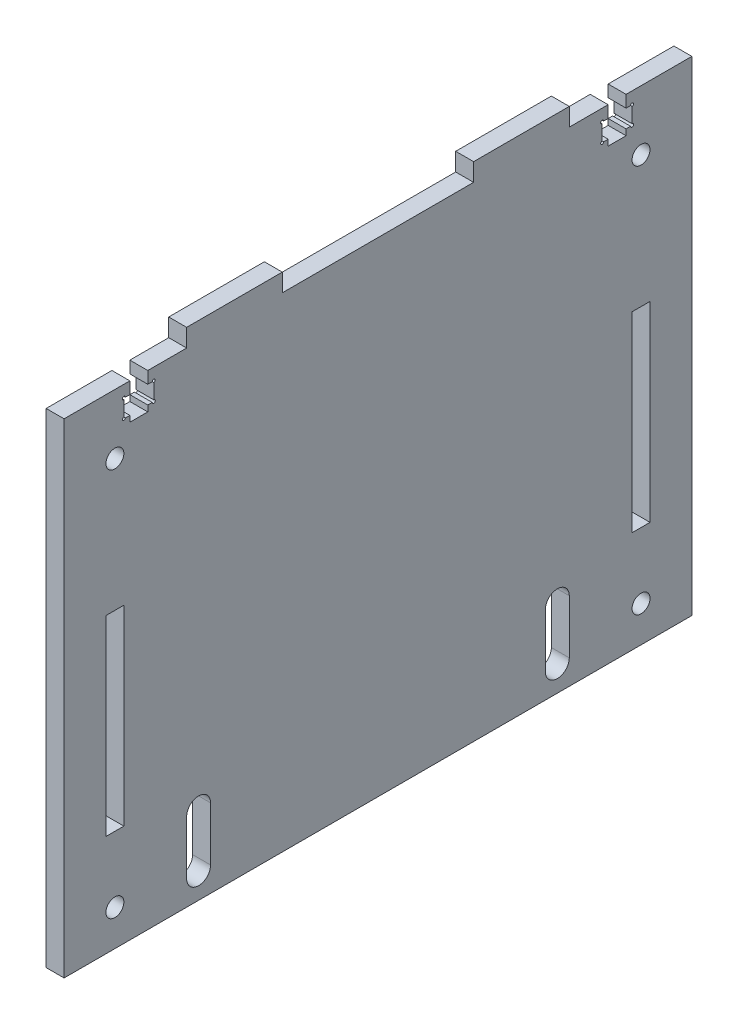
from build123d import *

# Parameters (mm, degrees)
CROQUIS1_R              = 1.5
CROQUIS1_W              = 3
CROQUIS1_H              = 32
SALIENTE_EXTRUIR1_DEPTH = 3
CORTAR_EXTRUIR1_DEPTH   = 3
CORTAR_EXTRUIR2_DEPTH   = 3


with BuildPart() as part:
    # Croquis1 → Saliente-Extruir1 (new body)
    with BuildSketch(Plane(origin=(0, 0, 0), x_dir=(0, 0, -1), z_dir=(1, 0, 0))):
        Polygon((0, 0), (105, 0), (105, 81), (84.5, 81), (84.5, 84), (68.5, 84), (68.5, 81), (36.5, 81), (36.5, 84), (20.5, 84), (20.5, 81), (0, 81), align=None)
        with Locations((8.5, 71)):
            Circle(CROQUIS1_R, mode=Mode.SUBTRACT)
        with Locations((96.5, 71)):
            Circle(CROQUIS1_R, mode=Mode.SUBTRACT)
        with Locations((8.5, 6)):
            Circle(CROQUIS1_R, mode=Mode.SUBTRACT)
        with Locations(Location((96.5, 6, 0), (0, 0, 180))):
            Circle(CROQUIS1_R, mode=Mode.SUBTRACT)
        with Locations((8.5, 33)):
            Rectangle(CROQUIS1_W, CROQUIS1_H, mode=Mode.SUBTRACT)
        with Locations((96.5, 33)):
            Rectangle(CROQUIS1_W, CROQUIS1_H, mode=Mode.SUBTRACT)
    extrude(amount=SALIENTE_EXTRUIR1_DEPTH)

    # Croquis2 → Cortar-Extruir1 (cut)
    with BuildSketch(Plane(origin=(3, 0, 0), x_dir=(0, 0, -1), z_dir=(1, 0, 0))):
        with BuildLine():
            Line((14, 79), (14, 81))
            Line((14, 81), (11, 81))
            Line((11, 81), (11, 79))
            Line((11, 79), (10.25, 79))
            ThreePointArc((10.25, 79), (9.823223305, 79.176776695), (10, 78.75))
            Line((10, 78.75), (10, 76.25))
            ThreePointArc((10, 76.25), (9.823223305, 75.823223305), (10.25, 76))
            Line((10.25, 76), (11, 76))
            Line((11, 76), (11, 75))
            Line((11, 75), (14, 75))
            Line((14, 75), (14, 76))
            Line((14, 76), (14.75, 76))
            ThreePointArc((14.75, 76), (15.176776695, 75.823223305), (15, 76.25))
            Line((15, 76.25), (15, 78.75))
            ThreePointArc((15, 78.75), (15.176776695, 79.176776695), (14.75, 79))
            Line((14.75, 79), (14, 79))
        make_face()
        with BuildLine():
            Line((94, 79), (94, 81))
            Line((94, 81), (91, 81))
            Line((91, 81), (91, 79))
            Line((91, 79), (90.25, 79))
            ThreePointArc((90.25, 79), (89.823223305, 79.176776695), (90, 78.75))
            Line((90, 78.75), (90, 76.25))
            ThreePointArc((90, 76.25), (89.823223305, 75.823223305), (90.25, 76))
            Line((90.25, 76), (91, 76))
            Line((91, 76), (91, 75))
            Line((91, 75), (94, 75))
            Line((94, 75), (94, 76))
            Line((94, 76), (94.75, 76))
            ThreePointArc((94.75, 76), (95.176776695, 75.823223305), (95, 76.25))
            Line((95, 76.25), (95, 78.75))
            ThreePointArc((95, 78.75), (95.176776695, 79.176776695), (94.75, 79))
            Line((94.75, 79), (94, 79))
        make_face()
    extrude(amount=-CORTAR_EXTRUIR1_DEPTH, mode=Mode.SUBTRACT)

    # Croquis3 → Cortar-Extruir2 (cut)
    with BuildSketch(Plane(origin=(3, 0, 0), x_dir=(0, 0, -1), z_dir=(1, 0, 0))):
        with BuildLine():
            Line((20.5, 4.122846639), (20.5, 13.122846639))
            ThreePointArc((20.5, 13.122846639), (22.5, 15.122846639), (24.5, 13.122846639))
            Line((24.5, 13.122846639), (24.5, 4.122846639))
            ThreePointArc((24.5, 4.122846639), (22.5, 2.122846639), (20.5, 4.122846639))
        make_face()
        with BuildLine():
            Line((84.5, 4.122846639), (84.5, 13.122846639))
            ThreePointArc((84.5, 13.122846639), (82.5, 15.122846639), (80.5, 13.122846639))
            Line((80.5, 13.122846639), (80.5, 4.122846639))
            ThreePointArc((80.5, 4.122846639), (82.5, 2.122846639), (84.5, 4.122846639))
        make_face()
    extrude(amount=-CORTAR_EXTRUIR2_DEPTH, mode=Mode.SUBTRACT)


solid = part.part
